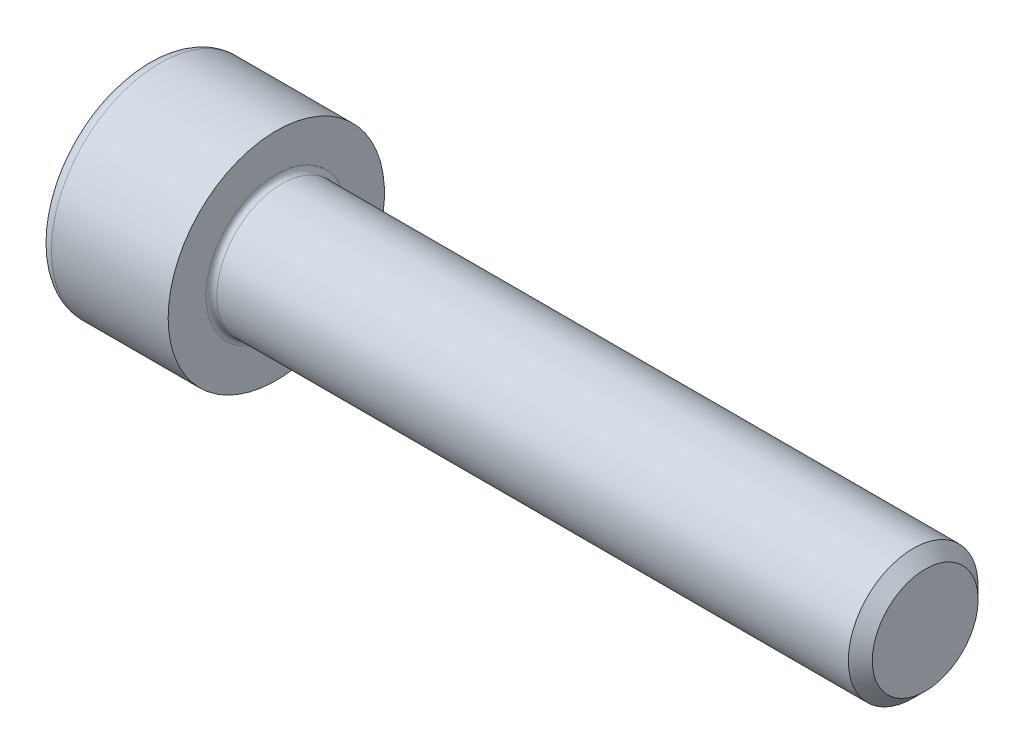
from build123d import *

# Parameters (mm, degrees)
FILLET1_R   = 0.25
FILLET2_R   = 0.6
HEX_2_DEPTH = 3


with BuildPart() as part:
    # BodySke → Base-Revolve (revolve)
    with BuildSketch(Plane.XY, mode=Mode.PRIVATE) as base_revolve_sk:
        Polygon((0, 0), (0, 5), (6, 5), (6, 3), (35.4455, 3), (36, 2.4455), (36, 0), align=None)
    revolve(base_revolve_sk.sketch.rotate(Axis((-31.75, 0, 0), (1, 0, 0)), 90), axis=Axis((-31.75, 0, 0), (1, 0, 0)))

    # Fillet1
    fillet1_edges = [part.edges().sort_by_distance(p)[0] for p in [
        (6, 0, -3),
    ]]
    fillet(fillet1_edges, radius=FILLET1_R)

    # Fillet2
    fillet2_edges = [part.edges().sort_by_distance(p)[0] for p in [
        (0, 0, -5),
    ]]
    fillet(fillet2_edges, radius=FILLET2_R)

    # Sketch2 → Hex-PreBroach (revolve, cut)
    with BuildSketch(Plane.XY, mode=Mode.PRIVATE) as hex_prebroach_sk:
        Polygon((0, 2.51), (3, 2.51), (4.449149176, 0), (0, 0), align=None)
    revolve(hex_prebroach_sk.sketch.rotate(Axis((0, 0, 0), (1, 0, 0)), 90), axis=Axis((0, 0, 0), (1, 0, 0)), mode=Mode.SUBTRACT)

    # Sketch3 → Hex 2 (cut)
    with BuildSketch(Plane(origin=(0, 0, 0), x_dir=(0, 0.500000000000001, 0.866025403784438), z_dir=(-1, 0, 0))):
        Polygon((1.449149176, 2.51), (-1.449149176, 2.51), (-2.898298351, 0), (-1.449149176, -2.51), (1.449149176, -2.51), (2.898298351, 0), align=None)
    extrude(amount=-HEX_2_DEPTH, mode=Mode.SUBTRACT)


solid = part.part
